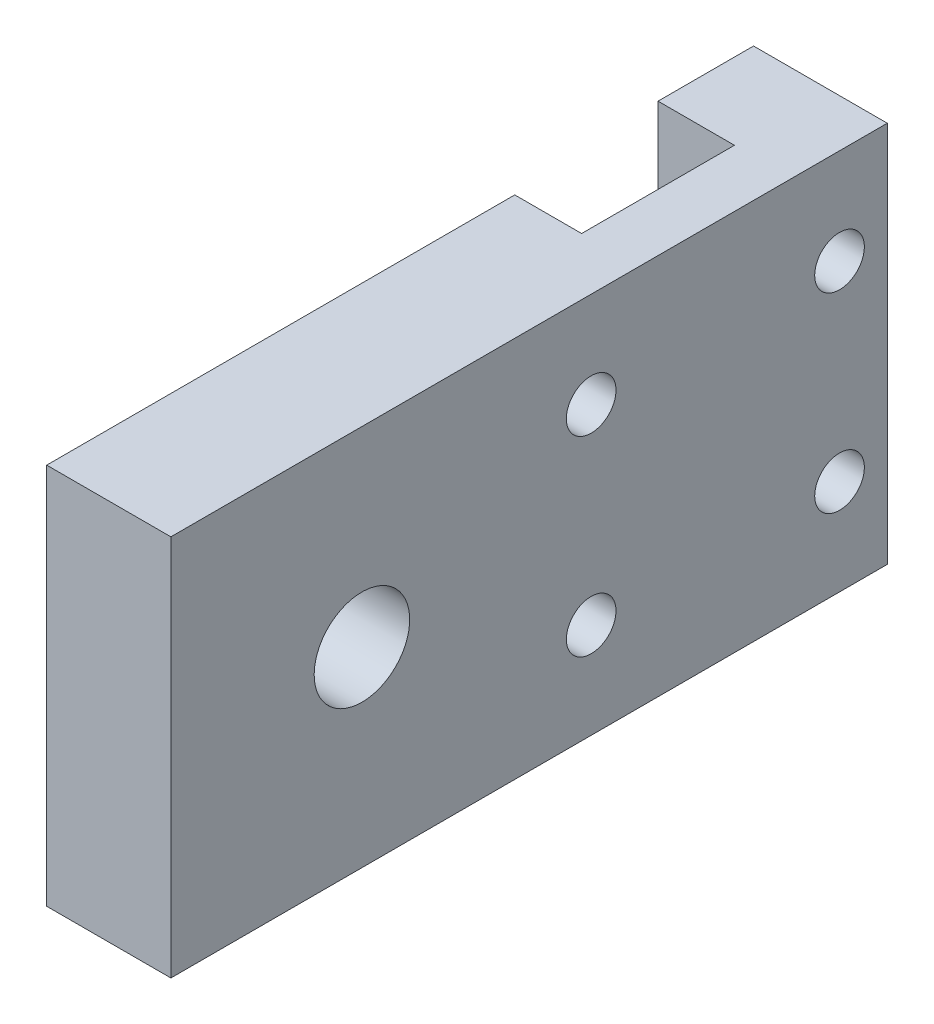
from build123d import *

# Parameters (mm, degrees)
BOSS_EXTRUDE1_DEPTH = 20
CUT_EXTRUDE1_REACH  = 25.446
SKETCH2_R           = 1.3
SKETCH4_W           = 6.5
SKETCH4_H           = 21.5
BOSS_EXTRUDE2_DEPTH = 20
CUT_EXTRUDE2_REACH  = 36.591
SKETCH6_R           = 1.3
CUT_EXTRUDE3_REACH  = 36.591
SKETCH7_R           = 2.5


with BuildPart() as part:
    # Sketch1 → Boss-Extrude1 (new body)
    with BuildSketch(Plane(origin=(0, 0, 0), x_dir=(-1, 0, 0), z_dir=(0, 1, 0))):
        Polygon((0, -5.035714286), (0, -10.035714286), (-7, -10.035714286), (-7, 5.964285714), (-0.5, 5.964285714), (-0.5, 2.964285714), (-4, 2.964285714), (-4, -5.035714286), align=None)
    extrude(amount=BOSS_EXTRUDE1_DEPTH)

    # Sketch2 → Cut-Extrude1 (cut, up to next)
    with BuildSketch(Plane(origin=(0, 0, 0), x_dir=(0, -1, 0), z_dir=(-1, 0, 0)), mode=Mode.PRIVATE) as cut_extrude1_sk1:
        with Locations(Location((-15, -7.535714286, 0), (0, 0, 90))):
            Circle(SKETCH2_R)
    cut_extrude1_tool1 = extrude(cut_extrude1_sk1.sketch, amount=-CUT_EXTRUDE1_REACH, mode=Mode.PRIVATE) & part.part
    # Sketch2 → Cut-Extrude1 (cut, up to next)
    with BuildSketch(Plane(origin=(0, 0, 0), x_dir=(0, -1, 0), z_dir=(-1, 0, 0)), mode=Mode.PRIVATE) as cut_extrude1_sk2:
        with Locations(Location((-5, -7.535714286, 0), (0, 0, 90))):
            Circle(SKETCH2_R)
    cut_extrude1_tool2 = extrude(cut_extrude1_sk2.sketch, amount=-CUT_EXTRUDE1_REACH, mode=Mode.PRIVATE) & part.part
    add(cut_extrude1_tool1.solids().sort_by_distance((0, 15, -7.535714))[0], mode=Mode.SUBTRACT)
    add(cut_extrude1_tool2.solids().sort_by_distance((0, 5, -7.535714))[0], mode=Mode.SUBTRACT)

    # Sketch4 → Boss-Extrude2 (add)
    with BuildSketch(Plane(origin=(0, 20, 0), x_dir=(-1, 0, 0), z_dir=(0, 1, 0))):
        with Locations((-3.75, 16.714285714)):
            Rectangle(SKETCH4_W, SKETCH4_H)
    extrude(amount=-BOSS_EXTRUDE2_DEPTH)

    # Sketch6 → Cut-Extrude2 (cut, up to next)
    with BuildSketch(Plane(origin=(0.5, 0, 0), x_dir=(0, -1, 0), z_dir=(-1, 0, 0)), mode=Mode.PRIVATE) as cut_extrude2_sk1:
        with Locations(Location((-15, 5.464285714, 0), (0, 0, 90))):
            Circle(SKETCH6_R)
    cut_extrude2_tool1 = extrude(cut_extrude2_sk1.sketch, amount=-CUT_EXTRUDE2_REACH, mode=Mode.PRIVATE) & part.part
    # Sketch6 → Cut-Extrude2 (cut, up to next)
    with BuildSketch(Plane(origin=(0.5, 0, 0), x_dir=(0, -1, 0), z_dir=(-1, 0, 0)), mode=Mode.PRIVATE) as cut_extrude2_sk2:
        with Locations(Location((-5, 5.464285714, 0), (0, 0, 90))):
            Circle(SKETCH6_R)
    cut_extrude2_tool2 = extrude(cut_extrude2_sk2.sketch, amount=-CUT_EXTRUDE2_REACH, mode=Mode.PRIVATE) & part.part
    add(cut_extrude2_tool1.solids().sort_by_distance((0.5, 15, 5.464286))[0], mode=Mode.SUBTRACT)
    add(cut_extrude2_tool2.solids().sort_by_distance((0.5, 5, 5.464286))[0], mode=Mode.SUBTRACT)

    # Sketch7 → Cut-Extrude3 (cut, up to next)
    with BuildSketch(Plane(origin=(0.5, 0, 0), x_dir=(0, -1, 0), z_dir=(-1, 0, 0)), mode=Mode.PRIVATE) as cut_extrude3_sk1:
        with Locations(Location((-10, 17.464285714, 0), (0, 0, 90))):
            Circle(SKETCH7_R)
    cut_extrude3_tool1 = extrude(cut_extrude3_sk1.sketch, amount=-CUT_EXTRUDE3_REACH, mode=Mode.PRIVATE) & part.part
    add(cut_extrude3_tool1.solids().sort_by_distance((0.5, 10, 17.464286))[0], mode=Mode.SUBTRACT)


solid = part.part
